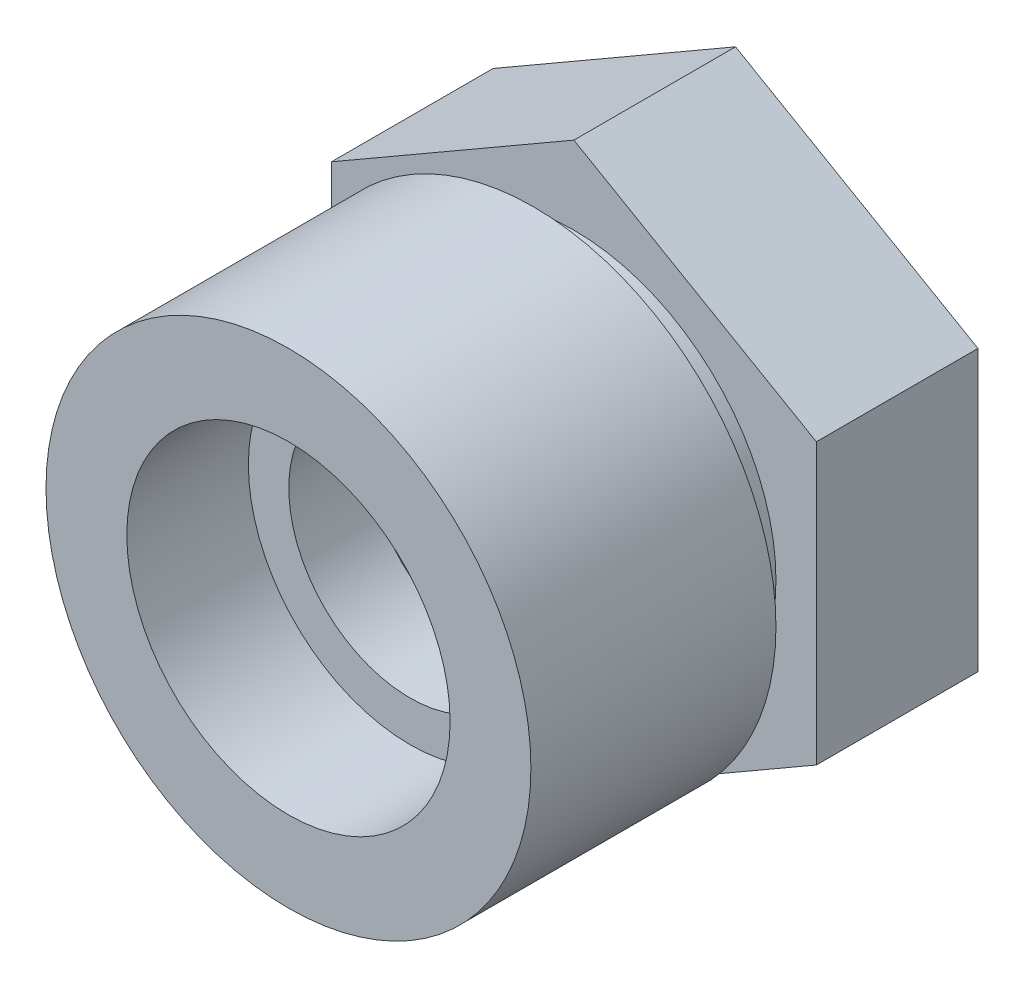
from build123d import *

# Parameters (mm, degrees)
BOSS_EXTRUDE1_DEPTH = 6.35
SKETCH2_R           = 7.9375
BOSS_EXTRUDE3_DEPTH = 1.5875
SKETCH7_R           = 9.525
BOSS_EXTRUDE4_DEPTH = 9.6266
SKETCH10_W          = 2.0193
SKETCH10_H          = 17.5641
SKETCH12_R          = 6.35
CUT_EXTRUDE5_DEPTH  = 4.7752
SKETCH13_R          = 4.7625
CUT_EXTRUDE6_DEPTH  = 3.048


with BuildPart() as part:
    # Sketch1 → Boss-Extrude1 (new body)
    with BuildSketch(Plane.XY):
        Polygon((0, -10.998522628), (9.525, -5.499261314), (9.525, 5.499261314), (0, 10.998522628), (-9.525, 5.499261314), (-9.525, -5.499261314), align=None)
    extrude(amount=-BOSS_EXTRUDE1_DEPTH)


with BuildPart() as body_2:
    # Sketch2 → Boss-Extrude3 (new body)
    with BuildSketch(Plane.XY):
        Circle(SKETCH2_R)
    extrude(amount=BOSS_EXTRUDE3_DEPTH)


with BuildPart() as body_3:
    # Sketch7 → Boss-Extrude4 (new body)
    with BuildSketch(Plane.XY.offset(1.5875)):
        Circle(SKETCH7_R)
    extrude(amount=BOSS_EXTRUDE4_DEPTH)


with BuildPart() as f_10_32_tapped_hole2_tool:
    # Sketch10 → #10-32 Tapped Hole2 (revolve)
    with BuildSketch(Plane(origin=(0, 0, -6.35), x_dir=(0, 1, 0), z_dir=(1, 0, 0))):
        with Locations((1.00965, 8.78205)):
            Rectangle(SKETCH10_W, SKETCH10_H)
    revolve(axis=Axis((0, 0, -12.7), (0, 0, 1)))


with BuildPart() as part_1:
    add(part.part)

    # #10-32 Tapped Hole2: cut by f_10_32_tapped_hole2_tool
    add(f_10_32_tapped_hole2_tool.part, mode=Mode.SUBTRACT)


with BuildPart() as body_2_1:
    add(body_2.part)

    # #10-32 Tapped Hole2: cut by f_10_32_tapped_hole2_tool
    add(f_10_32_tapped_hole2_tool.part, mode=Mode.SUBTRACT)


with BuildPart() as body_3_1:
    add(body_3.part)

    # #10-32 Tapped Hole2: cut by f_10_32_tapped_hole2_tool
    add(f_10_32_tapped_hole2_tool.part, mode=Mode.SUBTRACT)

    # Sketch12 → Cut-Extrude5 (cut)
    with BuildSketch(Plane.XY.offset(11.2141)):
        Circle(SKETCH12_R)
    extrude(amount=-CUT_EXTRUDE5_DEPTH, mode=Mode.SUBTRACT)

    # Sketch13 → Cut-Extrude6 (cut)
    with BuildSketch(Plane.XY.offset(6.4389)):
        Circle(SKETCH13_R)
    extrude(amount=-CUT_EXTRUDE6_DEPTH, mode=Mode.SUBTRACT)


solid = Compound([part_1.part, body_2_1.part, body_3_1.part])
